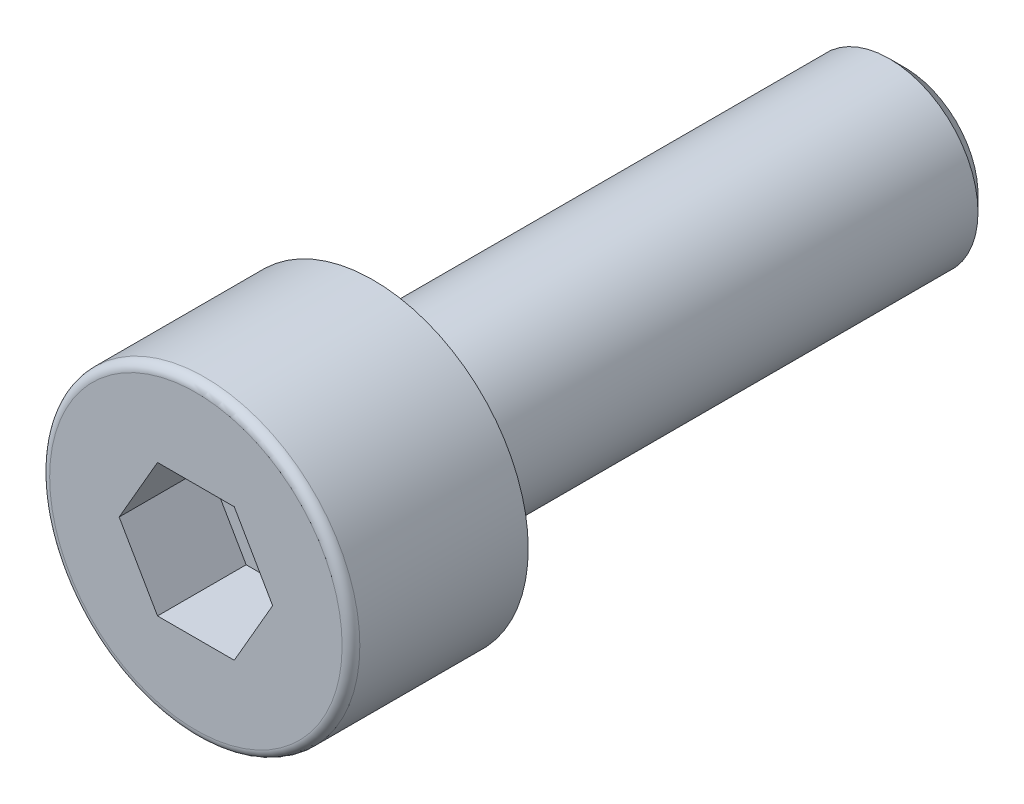
from build123d import *

# Parameters (mm, degrees)
CUT_EXTRUDE1_DEPTH = 2
CHAMFER1_SIZE      = 0.35


with BuildPart() as part:
    # Sketch1 → Revolve1 (revolve)
    with BuildSketch(Plane.XZ, mode=Mode.PRIVATE) as revolve1_sk:
        with BuildLine():
            Line((0, -12), (-2, -12))
            Line((-2, -12), (-2, 0))
            Line((-2, 0), (-3.5, 0))
            Line((-3.5, 0), (-3.5, 3.8))
            ThreePointArc((-3.5, 3.8), (-3.441421356, 3.941421356), (-3.3, 4))
            Line((-3.3, 4), (0, 4))
            Line((0, 4), (0, -12))
        make_face()
    revolve(revolve1_sk.sketch.rotate(Axis((0, 0, 4), (0, 0, -1)), 180), axis=Axis((0, 0, 4), (0, 0, -1)))

    # Sketch2 → Cut-Extrude1 (cut)
    with BuildSketch(Plane.XY.offset(4)):
        Polygon((1.732050808, 0), (0.866025404, 1.5), (-0.866025404, 1.5), (-1.732050808, 0), (-0.866025404, -1.5), (0.866025404, -1.5), align=None)
    extrude(amount=-CUT_EXTRUDE1_DEPTH, mode=Mode.SUBTRACT)

    # Chamfer1
    chamfer1_edges = [part.edges().sort_by_distance(p)[0] for p in [
        (-2, 0, -12),
    ]]
    chamfer(chamfer1_edges, length=CHAMFER1_SIZE)


solid = part.part
